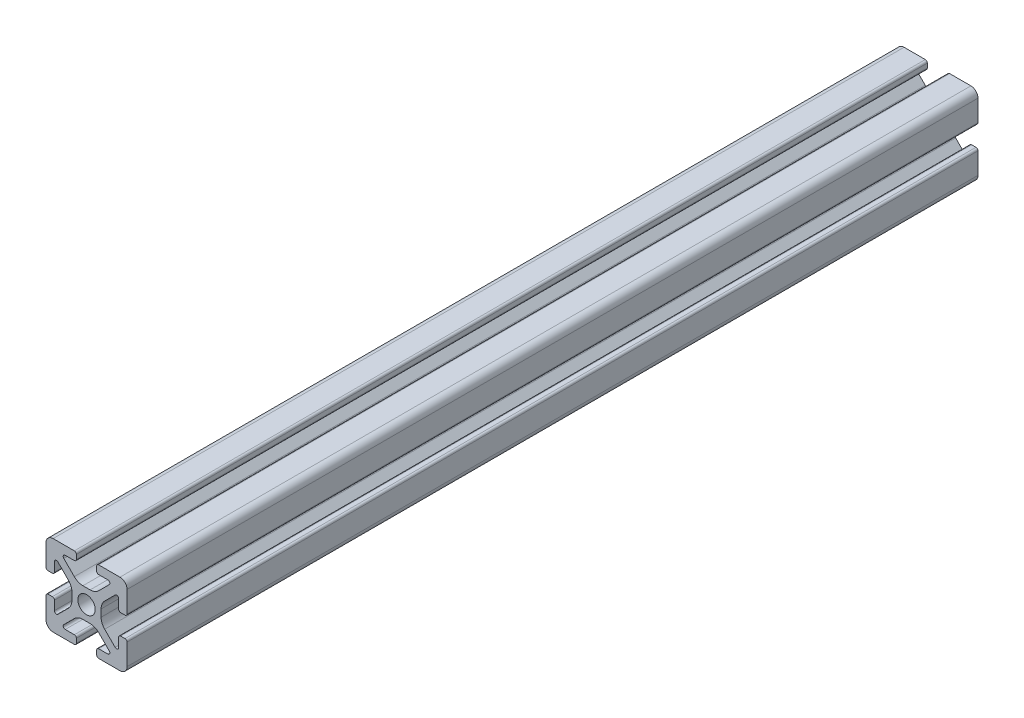
from build123d import *

# Parameters (mm, degrees)
BOSS_EXTRUDE1_DEPTH = 304.8
SKETCH5_W           = 26.995197012
SKETCH5_H           = 24.68705749
CUT_EXTRUDE1_DEPTH  = 399.6


with BuildPart() as part:
    # Sketch4 → Boss-Extrude1 (new, symmetric)
    with BuildSketch(Plane.XY):
        with BuildLine():
            Line((3, -10), (8.25, -10))
            ThreePointArc((8.25, -10), (9.487436867, -9.487436867), (10, -8.25))
            Line((10, -8.25), (10, -3))
            ThreePointArc((10, -3), (9.853553391, -2.646446609), (9.5, -2.5))
            Line((9.5, -2.5), (8.424621202, -2.5))
            ThreePointArc((8.424621202, -2.5), (8.071067812, -2.646446609), (7.924621202, -3))
            Line((7.924621202, -3), (7.924621202, -5.25))
            ThreePointArc((7.924621202, -5.25), (7.615962919, -5.711939766), (7.071067812, -5.603553391))
            Line((7.071067812, -5.603553391), (4.478679656, -3.011165235))
            ThreePointArc((4.478679656, -3.011165235), (3.828361402, -2.037895189), (3.6, -0.889844892))
            Line((3.6, -0.889844892), (3.6, 0))
            Line((3.6, 0), (2.15, 0))
            ThreePointArc((2.15, 0), (1.52027958, -1.52027958), (0, -2.15))
            Line((0, -2.15), (0, -3.6))
            Line((0, -3.6), (0.889844892, -3.6))
            ThreePointArc((0.889844892, -3.6), (2.037895189, -3.828361402), (3.011165235, -4.478679656))
            Line((3.011165235, -4.478679656), (5.603553391, -7.071067812))
            ThreePointArc((5.603553391, -7.071067812), (5.711939766, -7.615962919), (5.25, -7.924621202))
            Line((5.25, -7.924621202), (3, -7.924621202))
            ThreePointArc((3, -7.924621202), (2.646446609, -8.071067812), (2.5, -8.424621202))
            Line((2.5, -8.424621202), (2.5, -9.5))
            ThreePointArc((2.5, -9.5), (2.646446609, -9.853553391), (3, -10))
        make_face()
    extrude(amount=BOSS_EXTRUDE1_DEPTH, both=True)

    # Mirror1: part across plane


with BuildPart() as part_1:
    add(part.part)
    add(part.part.mirror(Plane(origin=(0, 0, 0), x_dir=(0, 0, 1), z_dir=(1, 0, 0))))

    # Mirror2: part across plane


with BuildPart() as part_2:
    add(part_1.part)
    add(part_1.part.mirror(Plane.ZX))

    # Sketch5 → Cut-Extrude1 (cut)
    with BuildSketch(Plane(origin=(0, 0, -304.8), x_dir=(-1, 0, 0), z_dir=(0, 0, -1))):
        with Locations((-0.333544011, -0.025224209)):
            Rectangle(SKETCH5_W, SKETCH5_H)
    extrude(amount=-CUT_EXTRUDE1_DEPTH, mode=Mode.SUBTRACT)


solid = part_2.part
